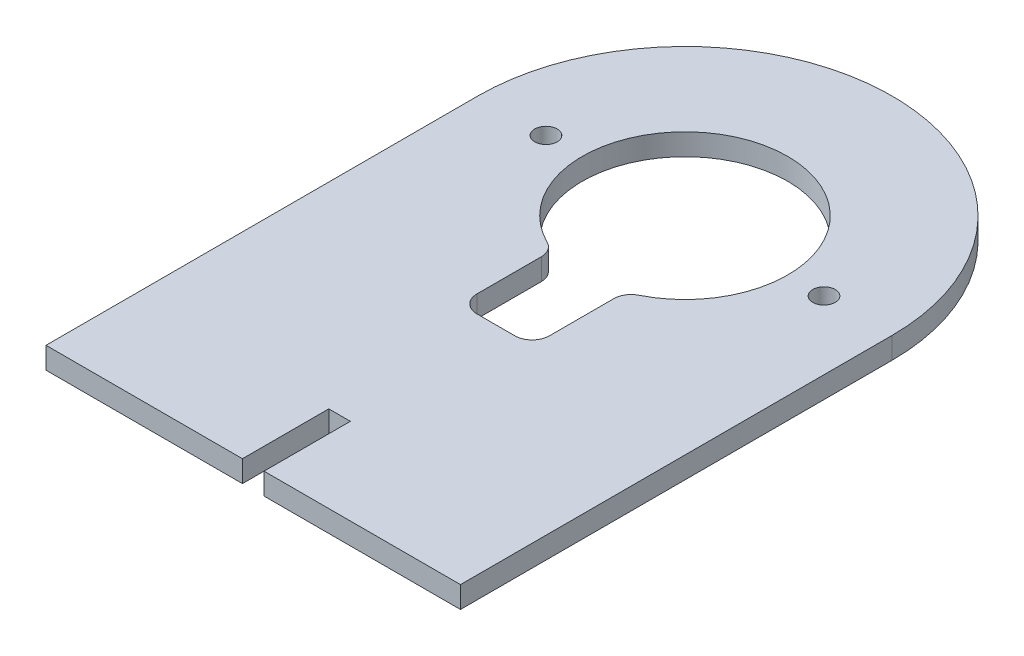
from build123d import *

# Parameters (mm, degrees)
SKETCH1_R           = 1.651
BOSS_EXTRUDE1_DEPTH = 3.175
FILLET2_R           = 2.54


with BuildPart() as part:
    # Sketch1 → Boss-Extrude1 (new body)
    with BuildSketch(Plane(origin=(0, 0, 0), x_dir=(1, 0, 0), z_dir=(0, 1, 0))):
        with BuildLine():
            Line((30.48, -63.5), (30.48, 0))
            ThreePointArc((30.48, 0), (0, 30.48), (-30.48, 0))
            Line((-30.48, 0), (-30.48, -63.5))
            Line((-30.48, -63.5), (-1.5875, -63.5))
            Line((-1.5875, -63.5), (-1.5875, -50.8))
            Line((-1.5875, -50.8), (1.5875, -50.8))
            Line((1.5875, -50.8), (1.5875, -63.5))
            Line((1.5875, -63.5), (30.48, -63.5))
        make_face()
        with Locations(Location((-20.447, 0, 0), (0, 0, 270))):
            Circle(SKETCH1_R, mode=Mode.SUBTRACT)
        with BuildLine():
            Line((5.334, -27.813), (-5.334, -27.813))
            Line((-5.334, -27.813), (-5.334, -14.140410638))
            ThreePointArc((-5.334, -14.140410638), (-8.596220885, 12.430114863), (15.113, 0))
            ThreePointArc((15.113, 0), (12.430114863, -8.596220885), (5.334, -14.140410638))
            Line((5.334, -14.140410638), (5.334, -27.813))
        make_face(mode=Mode.SUBTRACT)
        with Locations(Location((20.447, 0, 0), (0, 0, 270))):
            Circle(SKETCH1_R, mode=Mode.SUBTRACT)
    extrude(amount=BOSS_EXTRUDE1_DEPTH)

    # Fillet2
    fillet2_edges = [part.edges().sort_by_distance(p)[0] for p in [
        (-5.334, 1.5875, 14.140410638),
        (-5.334, 1.5875, 27.813),
        (5.334, 1.5875, 27.813),
        (5.334, 1.5875, 14.140410638),
    ]]
    fillet(fillet2_edges, radius=FILLET2_R)


solid = part.part
